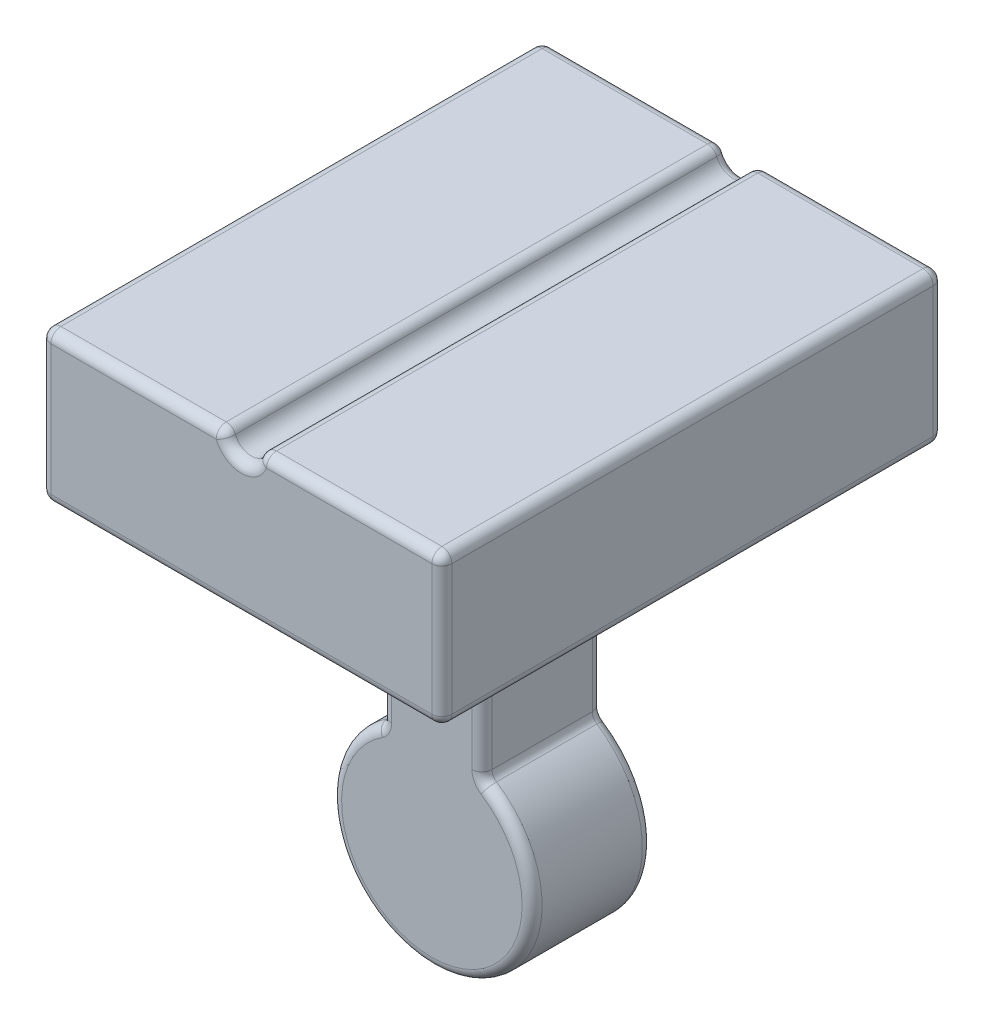
from build123d import *

# Parameters (mm, degrees)
EXTRUDE_1_DEPTH     = 12
SKETCH_2_W          = 40
SKETCH_2_H          = 50
EXTRUDE_2_DEPTH     = 15
SKETCH_3_R          = 1.7
CUT_EXTRUDE_2_DEPTH = 53
FILLET_1_R          = 1


with BuildPart() as part:
    # 草图1 → 凸台-拉伸1 (new body)
    with BuildSketch(Plane.XY):
        Polygon((5, 30), (5, 10), (5, 0), (0, 0), (-5, 0), (-5, 10), (-5, 30), align=None)
        with BuildLine():
            Line((-5, 0), (-5, 8.660254038))
            ThreePointArc((-5, 8.660254038), (0, -10), (5, 8.660254038))
            Line((5, 8.660254038), (5, 0))
            Line((5, 0), (0, 0))
            Line((0, 0), (-5, 0))
        make_face()
    extrude(amount=EXTRUDE_1_DEPTH)

    # 草图2 → 凸台-拉伸2 (add)
    with BuildSketch(Plane(origin=(0, 30, 0), x_dir=(1, 0, 0), z_dir=(0, 1, 0))):
        with Locations((0, -6)):
            Rectangle(SKETCH_2_W, SKETCH_2_H)
    extrude(amount=EXTRUDE_2_DEPTH)

    # 草图3 → 切除-拉伸2 (cut)
    with BuildSketch(Plane(origin=(0, 0, -19), x_dir=(-1, 0, 0), z_dir=(0, 0, -1))):
        with Locations((0, 45)):
            Circle(SKETCH_3_R)
    extrude(amount=-CUT_EXTRUDE_2_DEPTH, mode=Mode.SUBTRACT)

    # 圆角1
    fillet_1_edges = [part.edges().sort_by_distance(p)[0] for p in [
        (0, -10, 12),
        (5, 19.330127019, 12),
        (20, 30, 6),
        (20, 37.5, 31),
        (0, 30, -19),
        (20, 37.5, -19),
        (-20, 30, 6),
        (-20, 37.5, -19),
        (0, 30, 31),
        (-20, 37.5, 31),
        (20, 45, 6),
        (10.85, 45, -19),
        (-20, 45, 6),
        (-10.85, 45, 31),
        (0, 30, 12),
        (-10.85, 45, -19),
        (10.85, 45, 31),
        (-1.7, 45, 6),
        (1.7, 45, 6),
        (0, 43.3, 31),
        (0, 43.3, -19),
        (-5, 19.330127019, 12),
        (0, 30, 0),
        (5, 19.330127019, 0),
        (0, -10, 0),
        (-5, 19.330127019, 0),
        (-5, 30, 6),
        (5, 30, 6),
        (5, 8.660254038, 6),
        (-5, 8.660254038, 6),
    ]]
    fillet(fillet_1_edges, radius=FILLET_1_R)


solid = part.part
